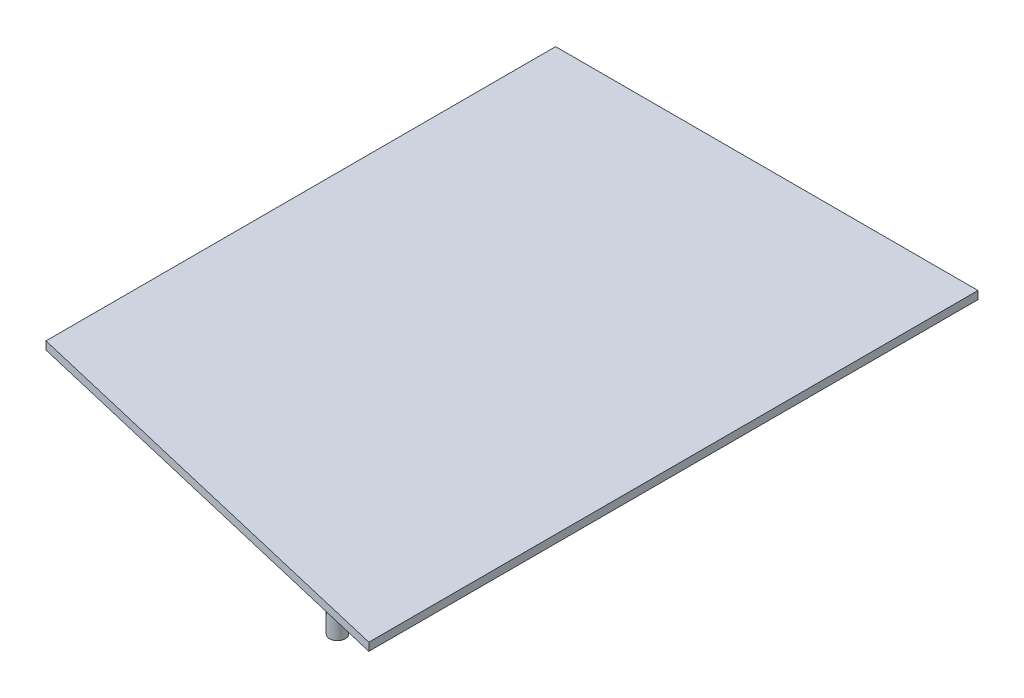
from build123d import *

# Parameters (mm, degrees)
BOSS_EXTRUDE1_DEPTH = 1.25
SKETCH2_R           = 1.25
SKETCH2_W           = 2.5
SKETCH2_H           = 2.5
BOSS_EXTRUDE2_DEPTH = 5
CUT_EXTRUDE1_DEPTH  = 0.6


with BuildPart() as part:
    # Sketch1 → Boss-Extrude1 (new body)
    with BuildSketch(Plane(origin=(0, 0, 0), x_dir=(1, 0, 0), z_dir=(0, 1, 0))):
        Polygon((0, 0), (0, 80), (66.3, 80), (66.3, -15.623791318), align=None)
    extrude(amount=BOSS_EXTRUDE1_DEPTH)

    # Sketch2 → Boss-Extrude2 (add)
    with BuildSketch(Plane.XZ):
        with Locations(Location((56.5, 10.745914737, 0), (0, 0, 270))):
            Circle(SKETCH2_R)
        with Locations((56.5, -77.5)):
            Rectangle(SKETCH2_W, SKETCH2_H)
        with Locations((2.5, -25)):
            Rectangle(SKETCH2_W, SKETCH2_H)
    extrude(amount=BOSS_EXTRUDE2_DEPTH)

    # Sketch3 → Cut-Extrude1 (cut)
    with BuildSketch(Plane(origin=(0, 0, 0), x_dir=(-1, 0, 0), z_dir=(0, -1, 0))):
        Polygon((-61.3, 75), (-61.3, -9.308571388), (-5, 3.958690319), (-5, 75), align=None)
    extrude(amount=-CUT_EXTRUDE1_DEPTH, mode=Mode.SUBTRACT)


solid = part.part
